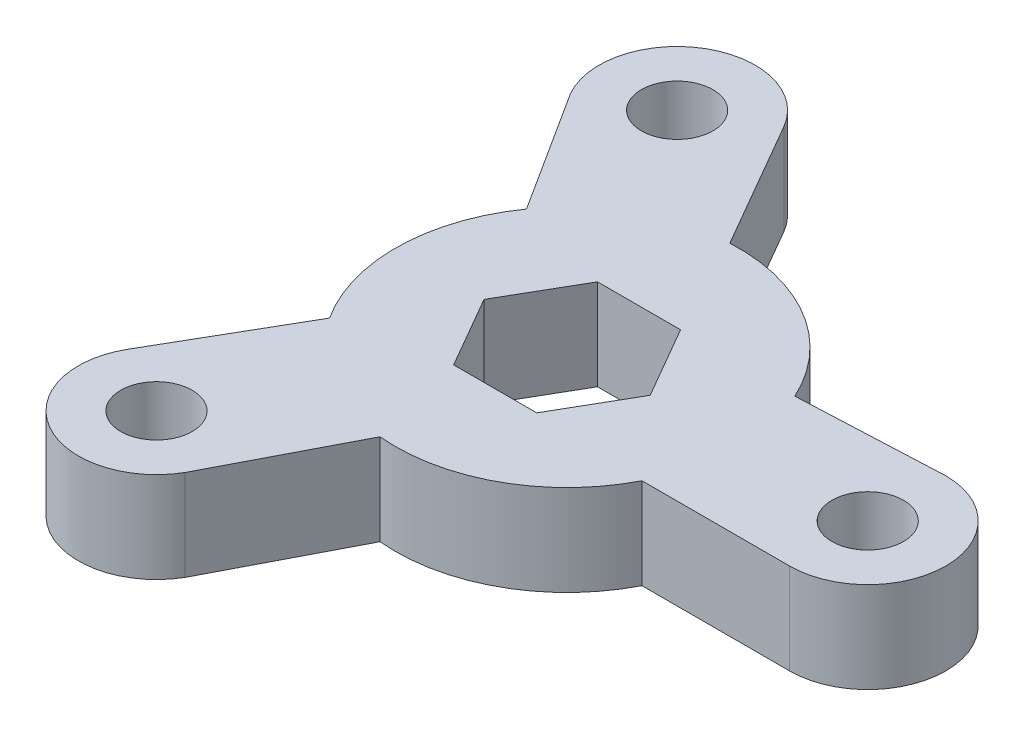
from build123d import *

# Parameters (mm, degrees)
SKETCH1_R           = 1.25
BOSS_EXTRUDE1_DEPTH = 3.175


with BuildPart() as part:
    # Sketch1 → Boss-Extrude1 (new body)
    with BuildSketch(Plane(origin=(0, 0, 0), x_dir=(1, 0, 0), z_dir=(0, 1, 0))):
        with BuildLine():
            Line((7.858300919, -2.484134681), (13.014762042, -2.484134681))
            ThreePointArc((13.014762042, -2.484134681), (15.743606535, 0.244709812), (13.014762042, 2.973554305))
            Line((13.014762042, 2.973554305), (7.969118099, 2.744709812))
            ThreePointArc((7.969118099, 2.744709812), (5.624188125, 5.376129638), (2.206241257, 6.236772472))
            Line((2.206241257, 6.236772472), (-0.371989304, 10.702398798))
            ThreePointArc((-0.371989304, 10.702398798), (-4.099660205, 11.701225206), (-5.098486612, 7.973554305))
            Line((-5.098486612, 7.973554305), (-2.377479496, 3.718320719))
            ThreePointArc((-2.377479496, 3.718320719), (-3.483890927, 0.371841879), (-2.520256051, -3.018508355))
            Line((-2.520256051, -3.018508355), (-5.098486612, -7.484134681))
            ThreePointArc((-5.098486612, -7.484134681), (-4.099660205, -11.211805582), (-0.371989304, -10.212979174))
            Line((-0.371989304, -10.212979174), (1.952647522, -5.728901095))
            ThreePointArc((1.952647522, -5.728901095), (5.403988927, -5.013842081), (7.858300919, -2.484134681))
        make_face()
        Polygon((3.965354593, 2.757209812), (5.415947144, 0.244709812), (3.965354593, -2.267790188), (1.06416949, -2.267790188), (-0.386423061, 0.244709812), (1.06416949, 2.757209812), align=None, mode=Mode.SUBTRACT)
        with Locations(Location((13.014762042, 0.244709812, 0), (0, 0, 270))):
            Circle(SKETCH1_R, mode=Mode.SUBTRACT)
        with Locations(Location((-2.735237958, 9.337976552, 0), (0, 0, 270))):
            Circle(SKETCH1_R, mode=Mode.SUBTRACT)
        with Locations(Location((-2.735237958, -8.848556928, 0), (0, 0, 270))):
            Circle(SKETCH1_R, mode=Mode.SUBTRACT)
    extrude(amount=BOSS_EXTRUDE1_DEPTH)


solid = part.part
